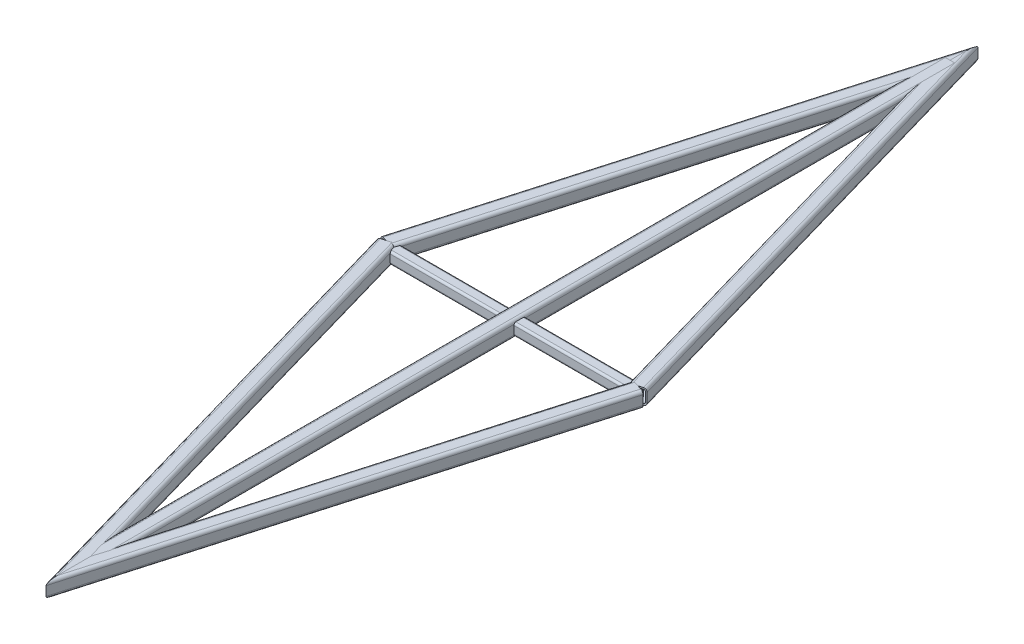
from build123d import *

# Parameters (mm, degrees)
SQUARE_TUBE_40_X_40_X_4_2_DEPTH        = 1277.839800624
SQUARE_TUBE_40_X_40_X_4_2_2_DEPTH      = 1178.274268897
SQUARE_TUBE_40_X_40_X_4_2_2_DEPTH_BACK = 99.565531726
SQUARE_TUBE_40_X_40_X_4_3_DEPTH        = 2265.131565932
SQUARE_TUBE_40_X_40_X_4_4_DEPTH        = 1277.839800624
SQUARE_TUBE_40_X_40_X_4_4_2_DEPTH      = 1178.274268897
SQUARE_TUBE_40_X_40_X_4_4_2_DEPTH_BACK = 99.565531726
SQUARE_TUBE_30_X_30_X_2_6_8_DEPTH      = 325
SQUARE_TUBE_30_X_30_X_2_6_8_2_DEPTH    = 325


with BuildPart() as part:
    # Sketch117 on segment 1 (carried to segment 1) → Square tube 40 X 40 X 4(2) (new body)
    with BuildSketch(Plane(origin=(-325, 500, 0), x_dir=(-0.961207261, 0, -0.275827122), z_dir=(0.275827122, 0, -0.961207261))):
        with BuildLine():
            Line((-12, -20), (12, -20))
            ThreePointArc((12, -20), (17.656854249, -17.656854249), (20, -12))
            Line((20, -12), (20, 12))
            ThreePointArc((20, 12), (17.656854249, 17.656854249), (12, 20))
            Line((12, 20), (-12, 20))
            ThreePointArc((-12, 20), (-17.656854249, 17.656854249), (-20, 12))
            Line((-20, 12), (-20, -12))
            ThreePointArc((-20, -12), (-17.656854249, -17.656854249), (-12, -20))
        make_face()
        with BuildLine():
            Line((-12, -16), (12, -16))
            ThreePointArc((12, -16), (14.828427125, -14.828427125), (16, -12))
            Line((16, -12), (16, 12))
            ThreePointArc((16, 12), (14.828427125, 14.828427125), (12, 16))
            Line((12, 16), (-12, 16))
            ThreePointArc((-12, 16), (-14.828427125, 14.828427125), (-16, 12))
            Line((-16, 12), (-16, -12))
            ThreePointArc((-16, -12), (-14.828427125, -14.828427125), (-12, -16))
        make_face(mode=Mode.SUBTRACT)
    extrude(amount=SQUARE_TUBE_40_X_40_X_4_2_DEPTH)

    # Square tube 40 X 40 X 4(2) mitre 1
    split(bisect_by=Plane(origin=(0, 500, -1132.565782966), x_dir=(0, -1, 0), z_dir=(-1, 0, 0)), keep=Keep.TOP)


with BuildPart() as body_2:
    # Sketch117 → Square tube 40 X 40 X 4_2 2 (new, two sides: drawn at the far end of the back side and taken through both)
    with BuildSketch(Plane(origin=(0, 500, -1132.565782966), x_dir=(0.9612072612142956, 2.0010330338498202e-15, -0.275827121561519), z_dir=(0.275827121561519, -1.4227899322223296e-14, 0.9612072612142956)).offset(-SQUARE_TUBE_40_X_40_X_4_2_2_DEPTH_BACK)):
        with BuildLine():
            Line((-12, -20), (12, -20))
            ThreePointArc((12, -20), (17.656854249, -17.656854249), (20, -12))
            Line((20, -12), (20, 12))
            ThreePointArc((20, 12), (17.656854249, 17.656854249), (12, 20))
            Line((12, 20), (-12, 20))
            ThreePointArc((-12, 20), (-17.656854249, 17.656854249), (-20, 12))
            Line((-20, 12), (-20, -12))
            ThreePointArc((-20, -12), (-17.656854249, -17.656854249), (-12, -20))
        make_face()
        with BuildLine():
            Line((-12, -16), (12, -16))
            ThreePointArc((12, -16), (14.828427125, -14.828427125), (16, -12))
            Line((16, -12), (16, 12))
            ThreePointArc((16, 12), (14.828427125, 14.828427125), (12, 16))
            Line((12, 16), (-12, 16))
            ThreePointArc((-12, 16), (-14.828427125, 14.828427125), (-16, 12))
            Line((-16, 12), (-16, -12))
            ThreePointArc((-16, -12), (-14.828427125, -14.828427125), (-12, -16))
        make_face(mode=Mode.SUBTRACT)
    extrude(amount=SQUARE_TUBE_40_X_40_X_4_2_2_DEPTH + SQUARE_TUBE_40_X_40_X_4_2_2_DEPTH_BACK)

    # Square tube 40 X 40 X 4_2 2 mitre 1
    split(bisect_by=Plane(origin=(0, 500, -1132.565782966), x_dir=(0, 1, 0), z_dir=(1, 0, 0)), keep=Keep.TOP)


with BuildPart() as body_3:
    # Sketch118 → Square tube 40 X 40 X 4(3) (new body)
    with BuildSketch(Plane(origin=(0, 500, 1132.565782966), x_dir=(1, 0, 0), z_dir=(0, 0, -1))):
        with BuildLine():
            Line((-12, -20), (12, -20))
            ThreePointArc((12, -20), (17.656854249, -17.656854249), (20, -12))
            Line((20, -12), (20, 12))
            ThreePointArc((20, 12), (17.656854249, 17.656854249), (12, 20))
            Line((12, 20), (-12, 20))
            ThreePointArc((-12, 20), (-17.656854249, 17.656854249), (-20, 12))
            Line((-20, 12), (-20, -12))
            ThreePointArc((-20, -12), (-17.656854249, -17.656854249), (-12, -20))
        make_face()
        with BuildLine():
            Line((-12, -16), (12, -16))
            ThreePointArc((12, -16), (14.828427125, -14.828427125), (16, -12))
            Line((16, -12), (16, 12))
            ThreePointArc((16, 12), (14.828427125, 14.828427125), (12, 16))
            Line((12, 16), (-12, 16))
            ThreePointArc((-12, 16), (-14.828427125, 14.828427125), (-16, 12))
            Line((-16, 12), (-16, -12))
            ThreePointArc((-16, -12), (-14.828427125, -14.828427125), (-12, -16))
        make_face(mode=Mode.SUBTRACT)
    extrude(amount=SQUARE_TUBE_40_X_40_X_4_3_DEPTH)


with BuildPart() as body_4:
    # Sketch119 on segment 1 (carried to segment 1) → Square tube 40 X 40 X 4(4) (new body)
    with BuildSketch(Plane(origin=(-325, 500, 0), x_dir=(0.961207261, 0, -0.275827122), z_dir=(0.275827122, 0, 0.961207261))):
        with BuildLine():
            Line((-12, -20), (12, -20))
            ThreePointArc((12, -20), (17.656854249, -17.656854249), (20, -12))
            Line((20, -12), (20, 12))
            ThreePointArc((20, 12), (17.656854249, 17.656854249), (12, 20))
            Line((12, 20), (-12, 20))
            ThreePointArc((-12, 20), (-17.656854249, 17.656854249), (-20, 12))
            Line((-20, 12), (-20, -12))
            ThreePointArc((-20, -12), (-17.656854249, -17.656854249), (-12, -20))
        make_face()
        with BuildLine():
            Line((-12, -16), (12, -16))
            ThreePointArc((12, -16), (14.828427125, -14.828427125), (16, -12))
            Line((16, -12), (16, 12))
            ThreePointArc((16, 12), (14.828427125, 14.828427125), (12, 16))
            Line((12, 16), (-12, 16))
            ThreePointArc((-12, 16), (-14.828427125, 14.828427125), (-16, 12))
            Line((-16, 12), (-16, -12))
            ThreePointArc((-16, -12), (-14.828427125, -14.828427125), (-12, -16))
        make_face(mode=Mode.SUBTRACT)
    extrude(amount=SQUARE_TUBE_40_X_40_X_4_4_DEPTH)

    # Square tube 40 X 40 X 4(4) mitre 1
    split(bisect_by=Plane(origin=(0, 500, 1132.565782966), x_dir=(0, -1, 0), z_dir=(-1, 0, 0)), keep=Keep.TOP)


with BuildPart() as body_5:
    # Sketch119 → Square tube 40 X 40 X 4_4 2 (new, two sides: drawn at the far end of the back side and taken through both)
    with BuildSketch(Plane(origin=(0, 500, 1132.565782966), x_dir=(-0.9612072612142956, 1.0116430648516472e-13, -0.2758271215615191), z_dir=(0.2758271215615191, -1.4227899322223312e-14, -0.9612072612142956)).offset(-SQUARE_TUBE_40_X_40_X_4_4_2_DEPTH_BACK)):
        with BuildLine():
            Line((-12, -20), (12, -20))
            ThreePointArc((12, -20), (17.656854249, -17.656854249), (20, -12))
            Line((20, -12), (20, 12))
            ThreePointArc((20, 12), (17.656854249, 17.656854249), (12, 20))
            Line((12, 20), (-12, 20))
            ThreePointArc((-12, 20), (-17.656854249, 17.656854249), (-20, 12))
            Line((-20, 12), (-20, -12))
            ThreePointArc((-20, -12), (-17.656854249, -17.656854249), (-12, -20))
        make_face()
        with BuildLine():
            Line((-12, -16), (12, -16))
            ThreePointArc((12, -16), (14.828427125, -14.828427125), (16, -12))
            Line((16, -12), (16, 12))
            ThreePointArc((16, 12), (14.828427125, 14.828427125), (12, 16))
            Line((12, 16), (-12, 16))
            ThreePointArc((-12, 16), (-14.828427125, 14.828427125), (-16, 12))
            Line((-16, 12), (-16, -12))
            ThreePointArc((-16, -12), (-14.828427125, -14.828427125), (-12, -16))
        make_face(mode=Mode.SUBTRACT)
    extrude(amount=SQUARE_TUBE_40_X_40_X_4_4_2_DEPTH + SQUARE_TUBE_40_X_40_X_4_4_2_DEPTH_BACK)

    # Square tube 40 X 40 X 4_4 2 mitre 1
    split(bisect_by=Plane(origin=(0, 500, 1132.565782966), x_dir=(0, 1, 0), z_dir=(1, 0, 0)), keep=Keep.TOP)


with BuildPart() as body_6:
    # Sketch123 → Square tube 30 X 30 X 2.6(8) (new body)
    with BuildSketch(Plane(origin=(0, 500, 0), x_dir=(0, 0, -1), z_dir=(1, 0, 0))):
        with BuildLine():
            Line((-9.8, -15), (9.8, -15))
            ThreePointArc((9.8, -15), (13.476955262, -13.476955262), (15, -9.8))
            Line((15, -9.8), (15, 9.8))
            ThreePointArc((15, 9.8), (13.476955262, 13.476955262), (9.8, 15))
            Line((9.8, 15), (-9.8, 15))
            ThreePointArc((-9.8, 15), (-13.476955262, 13.476955262), (-15, 9.8))
            Line((-15, 9.8), (-15, -9.8))
            ThreePointArc((-15, -9.8), (-13.476955262, -13.476955262), (-9.8, -15))
        make_face()
        with BuildLine():
            Line((-9.8, -12.4), (9.8, -12.4))
            ThreePointArc((9.8, -12.4), (11.638477631, -11.638477631), (12.4, -9.8))
            Line((12.4, -9.8), (12.4, 9.8))
            ThreePointArc((12.4, 9.8), (11.638477631, 11.638477631), (9.8, 12.4))
            Line((9.8, 12.4), (-9.8, 12.4))
            ThreePointArc((-9.8, 12.4), (-11.638477631, 11.638477631), (-12.4, 9.8))
            Line((-12.4, 9.8), (-12.4, -9.8))
            ThreePointArc((-12.4, -9.8), (-11.638477631, -11.638477631), (-9.8, -12.4))
        make_face(mode=Mode.SUBTRACT)
    extrude(amount=-SQUARE_TUBE_30_X_30_X_2_6_8_DEPTH)


with BuildPart() as body_7:
    # Sketch123 on segment 2 (carried to segment 2) → Square tube 30 X 30 X 2.6_8 2 (new body)
    with BuildSketch(Plane(origin=(0, 500, 0), x_dir=(0, 0, -1), z_dir=(1, 0, 0))):
        with BuildLine():
            Line((-9.8, -15), (9.8, -15))
            ThreePointArc((9.8, -15), (13.476955262, -13.476955262), (15, -9.8))
            Line((15, -9.8), (15, 9.8))
            ThreePointArc((15, 9.8), (13.476955262, 13.476955262), (9.8, 15))
            Line((9.8, 15), (-9.8, 15))
            ThreePointArc((-9.8, 15), (-13.476955262, 13.476955262), (-15, 9.8))
            Line((-15, 9.8), (-15, -9.8))
            ThreePointArc((-15, -9.8), (-13.476955262, -13.476955262), (-9.8, -15))
        make_face()
        with BuildLine():
            Line((-9.8, -12.4), (9.8, -12.4))
            ThreePointArc((9.8, -12.4), (11.638477631, -11.638477631), (12.4, -9.8))
            Line((12.4, -9.8), (12.4, 9.8))
            ThreePointArc((12.4, 9.8), (11.638477631, 11.638477631), (9.8, 12.4))
            Line((9.8, 12.4), (-9.8, 12.4))
            ThreePointArc((-9.8, 12.4), (-11.638477631, 11.638477631), (-12.4, 9.8))
            Line((-12.4, 9.8), (-12.4, -9.8))
            ThreePointArc((-12.4, -9.8), (-11.638477631, -11.638477631), (-9.8, -12.4))
        make_face(mode=Mode.SUBTRACT)
    extrude(amount=SQUARE_TUBE_30_X_30_X_2_6_8_2_DEPTH)


solid = Compound([part.part, body_2.part, body_3.part, body_4.part, body_5.part, body_6.part, body_7.part])
